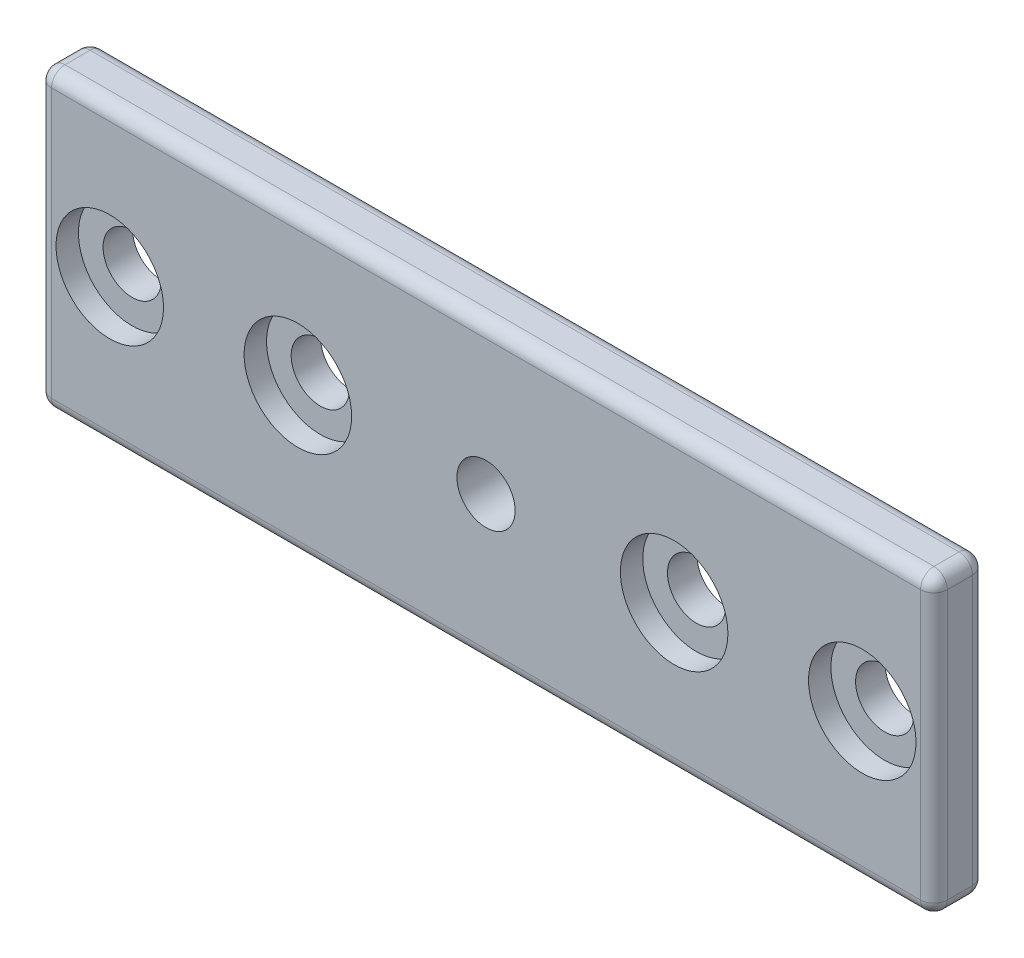
from build123d import *

# Parameters (mm, degrees)
SKETCH1_W           = 100
SKETCH1_H           = 33
BOSS_EXTRUDE1_DEPTH = 5.8
SKETCH2_R           = 3.25
CUT_EXTRUDE1_DEPTH  = 106.463927482
SKETCH3_R           = 6
CUT_EXTRUDE5_DEPTH  = 2.5
FILLET1_R           = 1.5


with BuildPart() as part:
    # Sketch1 → Boss-Extrude1 (new body)
    with BuildSketch(Plane.XY):
        with Locations((50, 16.5)):
            Rectangle(SKETCH1_W, SKETCH1_H)
    extrude(amount=BOSS_EXTRUDE1_DEPTH)

    # Sketch2 → Cut-Extrude1 (cut, through all)
    with BuildSketch(Plane.XY.offset(5.8)):
        with Locations((8, 16.5)):
            Circle(SKETCH2_R)
        with Locations((29, 16.5)):
            Circle(SKETCH2_R)
        with Locations((50, 16.5)):
            Circle(SKETCH2_R)
        with Locations((71, 16.5)):
            Circle(SKETCH2_R)
        with Locations((92, 16.5)):
            Circle(SKETCH2_R)
    extrude(amount=-CUT_EXTRUDE1_DEPTH, mode=Mode.SUBTRACT)

    # Sketch3 → Cut-Extrude5 (cut)
    with BuildSketch(Plane.XY.offset(5.8)):
        with Locations((8, 16.5)):
            Circle(SKETCH3_R)
        with Locations((29, 16.5)):
            Circle(SKETCH3_R)
        with Locations((71, 16.5)):
            Circle(SKETCH3_R)
        with Locations((92, 16.5)):
            Circle(SKETCH3_R)
    extrude(amount=-CUT_EXTRUDE5_DEPTH, mode=Mode.SUBTRACT)

    # Fillet1
    fillet1_edges = [part.edges().sort_by_distance(p)[0] for p in [
        (100, 16.5, 5.8),
        (50, 33, 5.8),
        (0, 16.5, 5.8),
        (50, 33, 0),
        (100, 16.5, 0),
        (50, 0, 0),
        (0, 16.5, 0),
        (0, 33, 2.9),
        (100, 33, 2.9),
        (100, 0, 2.9),
        (0, 0, 2.9),
        (50, 0, 5.8),
    ]]
    fillet(fillet1_edges, radius=FILLET1_R)


solid = part.part
